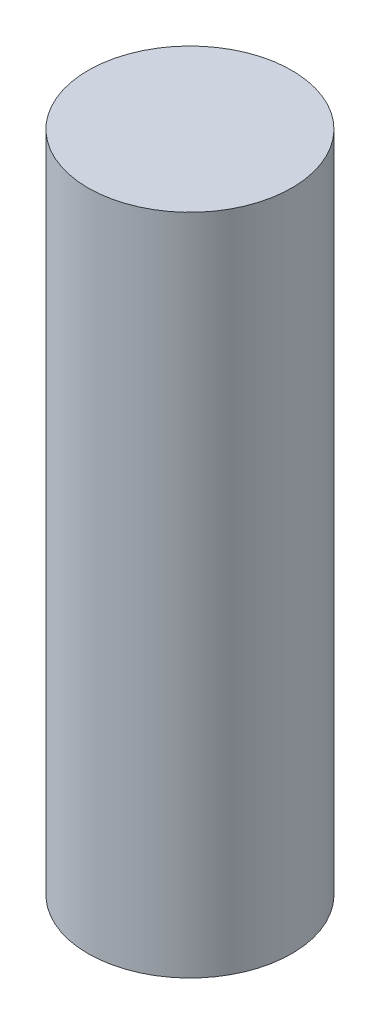
from build123d import *

# Parameters (mm, degrees)
SKETCH1_R           = 10.775
BOSS_EXTRUDE1_DEPTH = 70.15


with BuildPart() as part:
    # Sketch1 → Boss-Extrude1 (new body)
    with BuildSketch(Plane(origin=(0, 0, 0), x_dir=(1, 0, 0), z_dir=(0, 1, 0))):
        with Locations(Location((0, 0, 0), (0, 0, 270))):
            Circle(SKETCH1_R)
    extrude(amount=BOSS_EXTRUDE1_DEPTH)


solid = part.part
